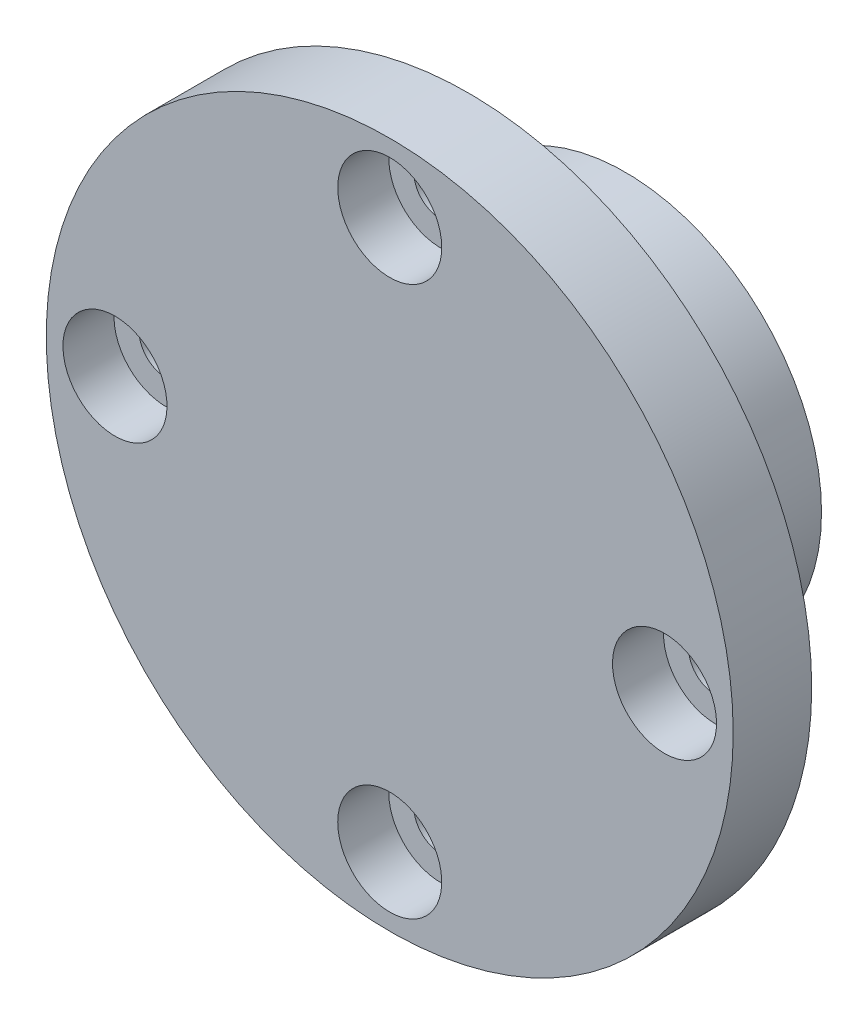
from build123d import *

# Parameters (mm, degrees)
SKETCH1_R           = 10
BOSS_EXTRUDE1_DEPTH = 8
SKETCH2_R           = 17.5
BOSS_EXTRUDE2_DEPTH = 4
CUT_EXTRUDE1_REACH  = 28.01
SKETCH3_R           = 1.375
CIRPATTERN1_COUNT   = 4
SKETCH4_R           = 2.65
CUT_EXTRUDE2_DEPTH  = 2.6
CIRPATTERN2_COUNT   = 4


with BuildPart() as part:
    # Sketch1 → Boss-Extrude1 (new body)
    with BuildSketch(Plane.XY):
        Circle(SKETCH1_R)
        Polygon((7.332348419, 0), (3.666174209, 6.35), (-3.666174209, 6.35), (-7.332348419, 0), (-3.666174209, -6.35), (3.666174209, -6.35), align=None, mode=Mode.SUBTRACT)
    extrude(amount=BOSS_EXTRUDE1_DEPTH)

    # Sketch2 → Boss-Extrude2 (add)
    with BuildSketch(Plane.XY.offset(8)):
        Circle(SKETCH2_R)
    extrude(amount=BOSS_EXTRUDE2_DEPTH)

    # Sketch3 → Cut-Extrude1 (cut, up to next)
    with BuildSketch(Plane(origin=(0, 0, 8), x_dir=(-1, 0, 0), z_dir=(0, 0, -1)), mode=Mode.PRIVATE) as cut_extrude1_sk1:
        with Locations((0, 14)):
            Circle(SKETCH3_R)
    cut_extrude1_tool1 = extrude(cut_extrude1_sk1.sketch, amount=-CUT_EXTRUDE1_REACH, mode=Mode.PRIVATE) & part.part
    cut_extrude1 = cut_extrude1_tool1.solids().sort_by_distance((0, 14, 8))[0]
    add(cut_extrude1, mode=Mode.SUBTRACT)

    # CirPattern1: Cut-Extrude1 ×4 about axis
    cirpattern1_axis = Axis((0, 0, 0), (0, 0, 1))
    for i in range(1, CIRPATTERN1_COUNT):
        add(cut_extrude1.rotate(cirpattern1_axis, i * 360 / CIRPATTERN1_COUNT), mode=Mode.SUBTRACT)

    # Sketch4 → Cut-Extrude2 (cut)
    with BuildSketch(Plane.XY.offset(12)):
        with Locations((0, 14)):
            Circle(SKETCH4_R)
    cut_extrude2 = extrude(amount=-CUT_EXTRUDE2_DEPTH, mode=Mode.SUBTRACT)

    # CirPattern2: Cut-Extrude2 ×4 about axis
    cirpattern2_axis = Axis((0, 0, 0), (0, 0, 1))
    for i in range(1, CIRPATTERN2_COUNT):
        add(cut_extrude2.rotate(cirpattern2_axis, i * 360 / CIRPATTERN2_COUNT), mode=Mode.SUBTRACT)


solid = part.part
